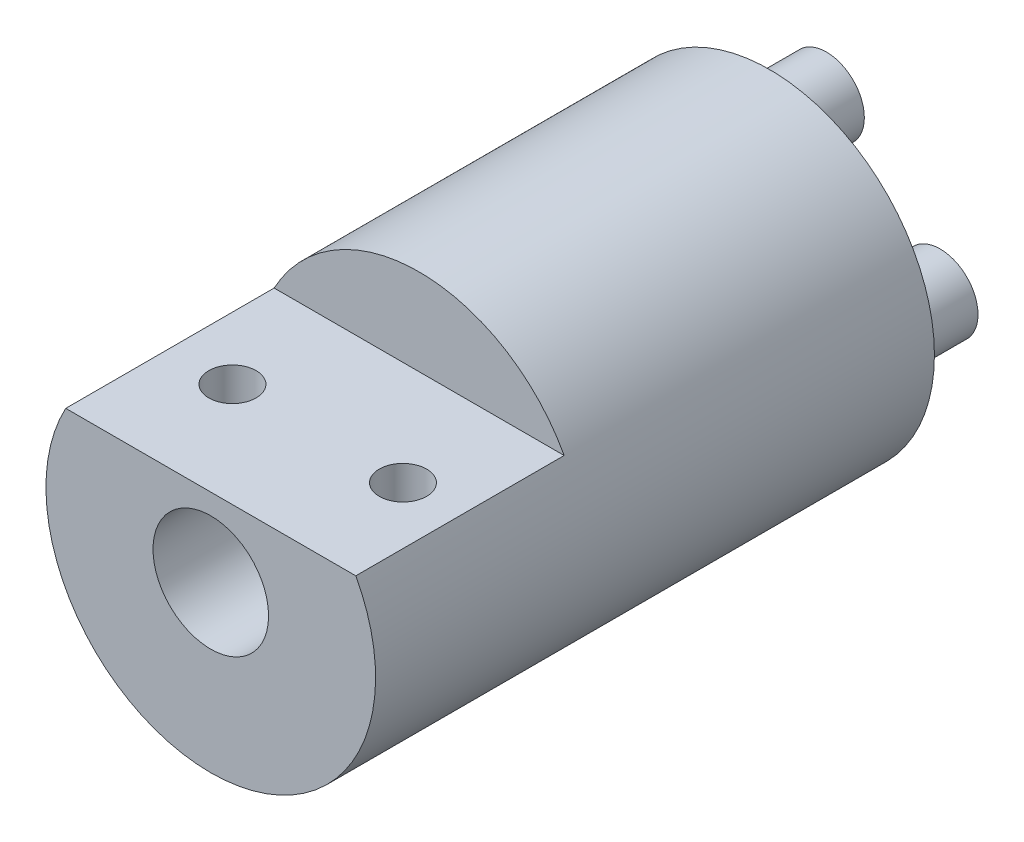
from build123d import *

# Parameters (mm, degrees)
SKETCH1_R                   = 8.7
BOSS_EXTRUDE1_DEPTH         = 29.5
SKETCH5_R                   = 1.75
CUT_EXTRUDE1_DEPTH          = 32.962947298
SKETCH6_R                   = 3.05
CUT_EXTRUDE3_DEPTH          = 26.5
SKETCH2_W                   = 17
SKETCH2_H                   = 4.566888769
CUT_EXTRUDE4_DEPTH          = 11
FILLET1_R                   = 0.3
TAP_DRILL_FOR_M3X0_5_TAP1_D = 2.5
SKETCH4_R                   = 2
BOSS_EXTRUDE2_DEPTH         = 3


with BuildPart() as part:
    # Sketch1 → Boss-Extrude1 (new body)
    with BuildSketch(Plane.XY):
        Circle(SKETCH1_R)
    extrude(amount=BOSS_EXTRUDE1_DEPTH)

    # Sketch5 → Cut-Extrude1 (cut, through all)
    with BuildSketch(Plane(origin=(0, 0, 0), x_dir=(-1, 0, 0), z_dir=(0, 0, -1))):
        Circle(SKETCH5_R)
    extrude(amount=-CUT_EXTRUDE1_DEPTH, mode=Mode.SUBTRACT)

    # Sketch6 → Cut-Extrude3 (cut)
    with BuildSketch(Plane.XY.offset(29.5)):
        Circle(SKETCH6_R)
    extrude(amount=-CUT_EXTRUDE3_DEPTH, mode=Mode.SUBTRACT)

    # Sketch2 → Cut-Extrude4 (cut)
    with BuildSketch(Plane.XY.offset(29.5)):
        with Locations((0.844453543, 6.416555616)):
            Rectangle(SKETCH2_W, SKETCH2_H)
    extrude(amount=-CUT_EXTRUDE4_DEPTH, mode=Mode.SUBTRACT)

    # Fillet1
    fillet1_edges = [part.edges().sort_by_distance(p)[0] for p in [
        (1.75, 0, 3),
    ]]
    fillet(fillet1_edges, radius=FILLET1_R)

    # Tap Drill for M3x0.5 Tap1 (through all)
    with Locations(Plane(origin=(0, 4.133111231, 0), x_dir=(1, 0, 0), z_dir=(0, 1, 0))):
        with Locations((4.644453543, -24), (-4.355546457, -24)):
            Hole(TAP_DRILL_FOR_M3X0_5_TAP1_D / 2)

    # Sketch4 → Boss-Extrude2 (add)
    with BuildSketch(Plane(origin=(0, 0, 0), x_dir=(-1, 0, 0), z_dir=(0, 0, -1))):
        with Locations(Location((0, 6, 0), (0, 0, 180))):
            Circle(SKETCH4_R)
        with Locations(Location((6, 0, 0), (0, 0, 180))):
            Circle(SKETCH4_R)
        with Locations(Location((0, -6, 0), (0, 0, 180))):
            Circle(SKETCH4_R)
        with Locations(Location((-6, 0, 0), (0, 0, 180))):
            Circle(SKETCH4_R)
    extrude(amount=BOSS_EXTRUDE2_DEPTH)


solid = part.part
